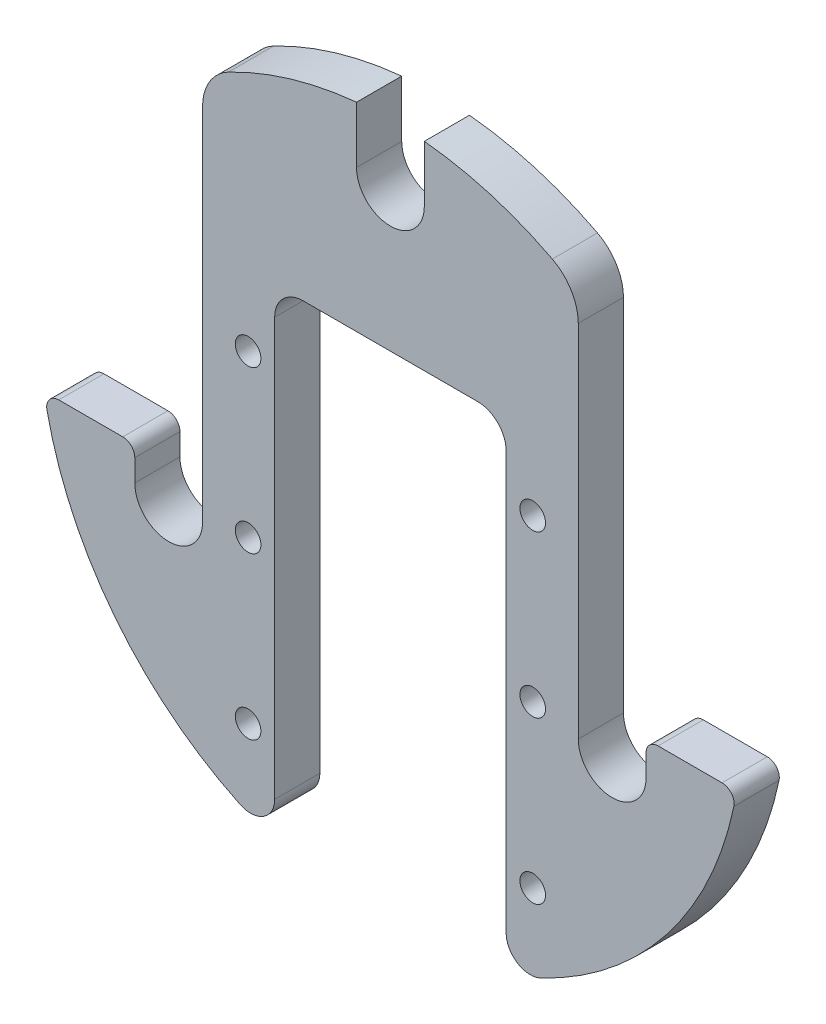
from build123d import *

# Parameters (mm, degrees)
SKETCH2_R                   = 1.35
BOSS_EXTRUDE1_DEPTH         = 4.7625
F_1_4_CLEARANCE_HOLE1_D     = 7.14248
F_1_4_CLEARANCE_HOLE1_DEPTH = 6.35
F_1_4_CLEARANCE_HOLE1_TIP   = 2.145817477
CUT_EXTRUDE1_START          = -4.7625
CUT_EXTRUDE1_DEPTH          = 4.7625


with BuildPart() as part:
    # Sketch2 → Boss-Extrude1 (new body)
    with BuildSketch(Plane.XY):
        with BuildLine():
            Line((-9.2, 12), (9.2, 12))
            ThreePointArc((9.2, 12), (11.321320344, 11.121320344), (12.2, 9))
            Line((12.2, 9), (12.2, -30))
            Line((12.2, -30), (12.2, -35.006033217))
            ThreePointArc((12.2, -35.006033217), (13.381504408, -37.152213482), (15.826842305, -37.301762688))
            ThreePointArc((15.826842305, -37.301762688), (36.936087169, -1.910874265), (12.2, 31.047299132))
            ThreePointArc((12.2, 31.047299132), (0, 33.117218452), (-12.2, 31.047299132))
            ThreePointArc((-12.2, 31.047299132), (-36.936087169, -1.910874265), (-15.826842305, -37.301762688))
            ThreePointArc((-15.826842305, -37.301762688), (-13.381504408, -37.152213482), (-12.2, -35.006033217))
            Line((-12.2, -35.006033217), (-12.2, -30))
            Line((-12.2, -30), (-12.2, 9))
            ThreePointArc((-12.2, 9), (-11.321320344, 11.121320344), (-9.2, 12))
        make_face()
        with Locations(Location((-15, -12.5, 0), (0, 0, 180))):
            Circle(SKETCH2_R, mode=Mode.SUBTRACT)
        with Locations(Location((-15, 4.5, 0), (0, 0, 180))):
            Circle(SKETCH2_R, mode=Mode.SUBTRACT)
        with Locations(Location((-15, -29.5, 0), (0, 0, 180))):
            Circle(SKETCH2_R, mode=Mode.SUBTRACT)
        with Locations(Location((15, -29.5, 0), (0, 0, 180))):
            Circle(SKETCH2_R, mode=Mode.SUBTRACT)
        with Locations(Location((15, -12.5, 0), (0, 0, 180))):
            Circle(SKETCH2_R, mode=Mode.SUBTRACT)
        with Locations(Location((15, 4.5, 0), (0, 0, 180))):
            Circle(SKETCH2_R, mode=Mode.SUBTRACT)
    extrude(amount=BOSS_EXTRUDE1_DEPTH)

    # 1/4 Clearance Hole1
    with Locations(Plane.XY.offset(4.7625)):
        with Locations((-23.371860585, -13.49375), (23.371860585, -13.49375), (0, 26.9875)):
            Hole(F_1_4_CLEARANCE_HOLE1_D / 2, depth=F_1_4_CLEARANCE_HOLE1_DEPTH)
            with Locations((0, 0, -(F_1_4_CLEARANCE_HOLE1_DEPTH + F_1_4_CLEARANCE_HOLE1_TIP / 2))):  # 118° drill point
                Cone(0, F_1_4_CLEARANCE_HOLE1_D / 2, F_1_4_CLEARANCE_HOLE1_TIP, mode=Mode.SUBTRACT)

    # Sketch5 → Cut-Extrude1 (cut)
    with BuildSketch(Plane.XY.offset(4.7625).offset(CUT_EXTRUDE1_START)):
        with BuildLine():
            ThreePointArc((19.800620585, 27.370987986), (18.449246292, 28.187570965), (17.064253254, 28.945736198))
            ThreePointArc((17.064253254, 28.945736198), (19.062973286, 27.075010458), (19.800620585, 24.438654446))
            Line((19.800620585, 24.438654446), (19.800620585, -13.49375))
            ThreePointArc((19.800620585, -13.49375), (23.371860585, -9.92251), (26.943100585, -13.49375))
            Line((26.943100585, -13.49375), (26.943100585, -11.19251))
            ThreePointArc((26.943100585, -11.19251), (27.315074973, -10.294484388), (28.213100585, -9.92251))
            Line((28.213100585, -9.92251), (34.959580577, -9.92251))
            ThreePointArc((34.959580577, -9.92251), (35.94535967, -10.391798079), (36.202612185, -11.45284137))
            ThreePointArc((36.202612185, -11.45284137), (36.354175005, -10.689186113), (36.48963119, -9.92251))
            ThreePointArc((36.48963119, -9.92251), (33.761655161, 11.237661484), (19.800620585, 27.370987986))
        make_face()
        with BuildLine():
            ThreePointArc((-3.57124, 26.9875), (0, 30.55874), (3.57124, 26.9875))
            Line((3.57124, 26.9875), (3.57124, 32.94441106))
            ThreePointArc((3.57124, 32.94441106), (0, 33.117218452), (-3.57124, 32.94441106))
            Line((-3.57124, 32.94441106), (-3.57124, 26.9875))
        make_face()
        with BuildLine():
            ThreePointArc((-19.800620585, 24.438654446), (-19.062973286, 27.075010458), (-17.064253254, 28.945736198))
            ThreePointArc((-17.064253254, 28.945736198), (-18.449246292, 28.187570965), (-19.800620585, 27.370987986))
            ThreePointArc((-19.800620585, 27.370987986), (-33.761655161, 11.237661484), (-36.48963119, -9.92251))
            ThreePointArc((-36.48963119, -9.92251), (-36.354175005, -10.689186113), (-36.202612185, -11.45284137))
            ThreePointArc((-36.202612185, -11.45284137), (-35.94535967, -10.391798079), (-34.959580577, -9.92251))
            Line((-34.959580577, -9.92251), (-28.213100585, -9.92251))
            ThreePointArc((-28.213100585, -9.92251), (-27.315074973, -10.294484388), (-26.943100585, -11.19251))
            Line((-26.943100585, -11.19251), (-26.943100585, -13.49375))
            ThreePointArc((-26.943100585, -13.49375), (-23.371860585, -9.92251), (-19.800620585, -13.49375))
            Line((-19.800620585, -13.49375), (-19.800620585, 24.438654446))
        make_face()
    extrude(amount=CUT_EXTRUDE1_DEPTH, mode=Mode.SUBTRACT)


solid = part.part
